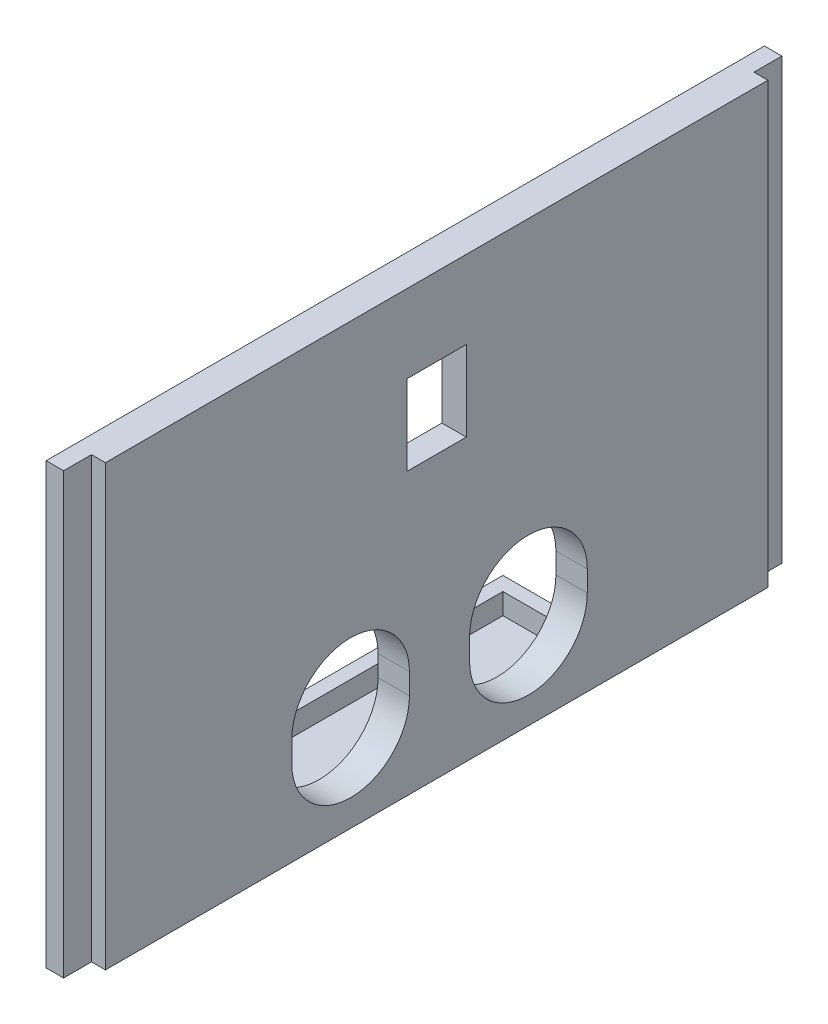
from build123d import *

# Parameters (mm, degrees)
SKETCH_1_W          = 2.5
SKETCH_1_H          = 103
SKETCH_1_W_2        = 2
SKETCH_1_H_2        = 95
EXTRUDE_1_DEPTH     = 63
SKETCH_5_W          = 50
SKETCH_5_H          = 2
EXTRUDE_2_DEPTH     = 11
EXTRUDE_3_DEPTH     = 3
CUT_EXTRUDE_1_DEPTH = 4.5
SKETCH_11_W         = 8.5
SKETCH_11_H         = 11.5
CUT_EXTRUDE_2_DEPTH = 4.5
SKETCH_12_W         = 26
SKETCH_12_H         = 28
SKETCH_12_W_2       = 25
SKETCH_12_H_2       = 27
SKETCH_12_W_3       = 8.5
SKETCH_12_H_3       = 11.5
CUT_EXTRUDE_3_DEPTH = 1
SKETCH_13_W         = 30
SKETCH_13_H         = 2
EXTRUDE_4_DEPTH     = 4
EXTRUDE_5_DEPTH     = 3


with BuildPart() as part:
    # 스케치1 → 보스-돌출1 (new body)
    with BuildSketch(Plane(origin=(0, 0, 0), x_dir=(1, 0, 0), z_dir=(0, 1, 0))):
        with Locations((-1, 0)):
            Rectangle(SKETCH_1_W, SKETCH_1_H)
        with Locations((1.25, 0)):
            Rectangle(SKETCH_1_W_2, SKETCH_1_H_2)
    extrude(amount=EXTRUDE_1_DEPTH)

    # 스케치5 → 보스-돌출2 (add)
    with BuildSketch(Plane.ZY.offset(2.25)):
        with Locations((0, 1)):
            Rectangle(SKETCH_5_W, SKETCH_5_H)
    extrude(amount=EXTRUDE_2_DEPTH)

    # 스케치7 → 보스-돌출3 (add)
    with BuildSketch(Plane(origin=(0, 2, 0), x_dir=(1, 0, 0), z_dir=(0, 1, 0))):
        Polygon((-2.25, 23), (-11.25, 23), (-11.25, -23), (-2.25, -23), (-2.25, -25), (-13.25, -25), (-13.25, 25), (-2.25, 25), align=None)
    extrude(amount=EXTRUDE_3_DEPTH)

    # 스케치10 → 컷-돌출1 (cut)
    with BuildSketch(Plane(origin=(2.25, 0, 0), x_dir=(0, 0, -1), z_dir=(1, 0, 0))):
        with BuildLine():
            Line((-20.78, 15.25), (-20.78, 12.25))
            ThreePointArc((-20.78, 12.25), (-12.34, 3.81), (-3.9, 12.25))
            Line((-3.9, 12.25), (-3.9, 15.25))
            ThreePointArc((-3.9, 15.25), (-12.34, 23.69), (-20.78, 15.25))
        make_face()
        with BuildLine():
            Line((4.72, 15.25), (4.72, 12.25))
            ThreePointArc((4.72, 12.25), (13.16, 3.81), (21.6, 12.25))
            Line((21.6, 12.25), (21.6, 15.25))
            ThreePointArc((21.6, 15.25), (13.16, 23.69), (4.72, 15.25))
        make_face()
    extrude(amount=-CUT_EXTRUDE_1_DEPTH, mode=Mode.SUBTRACT)

    # 스케치11 → 컷-돌출2 (cut)
    with BuildSketch(Plane.ZY.offset(2.25)):
        with Locations((0, 46.05)):
            Rectangle(SKETCH_11_W, SKETCH_11_H)
    extrude(amount=-CUT_EXTRUDE_2_DEPTH, mode=Mode.SUBTRACT)

    # 스케치12 → 컷-돌출3 (cut)
    # profile 1 of 2: a face of its own
    with BuildSketch(Plane.ZY.offset(2.25)):
        with Locations((0, 43.5)):
            Rectangle(SKETCH_12_W, SKETCH_12_H)
        with Locations((0, 43.5)):
            Rectangle(SKETCH_12_W_2, SKETCH_12_H_2, mode=Mode.SUBTRACT)
    # profile 2 of 2: a face of its own
    with BuildSketch(Plane.ZY.offset(2.25)):
        with Locations((0, 43.5)):
            Rectangle(SKETCH_12_W_2, SKETCH_12_H_2)
        with Locations((0, 46.05)):
            Rectangle(SKETCH_12_W_3, SKETCH_12_H_3, mode=Mode.SUBTRACT)
    extrude(amount=-CUT_EXTRUDE_3_DEPTH, mode=Mode.SUBTRACT)

    # 스케치13 → 보스-돌출4 (add)
    with BuildSketch(Plane.ZY.offset(2.25)):
        with Locations((0, 28.5)):
            Rectangle(SKETCH_13_W, SKETCH_13_H)
    extrude(amount=EXTRUDE_4_DEPTH)

    # 스케치14 → 보스-돌출5 (add)
    with BuildSketch(Plane(origin=(0, 29.5, 0), x_dir=(1, 0, 0), z_dir=(0, 1, 0))):
        Polygon((-2.25, -13), (-2.25, -15), (-6.25, -15), (-6.25, 15), (-2.25, 15), (-2.25, 13), (-4.25, 13), (-4.25, -13), align=None)
    extrude(amount=EXTRUDE_5_DEPTH)


solid = part.part
